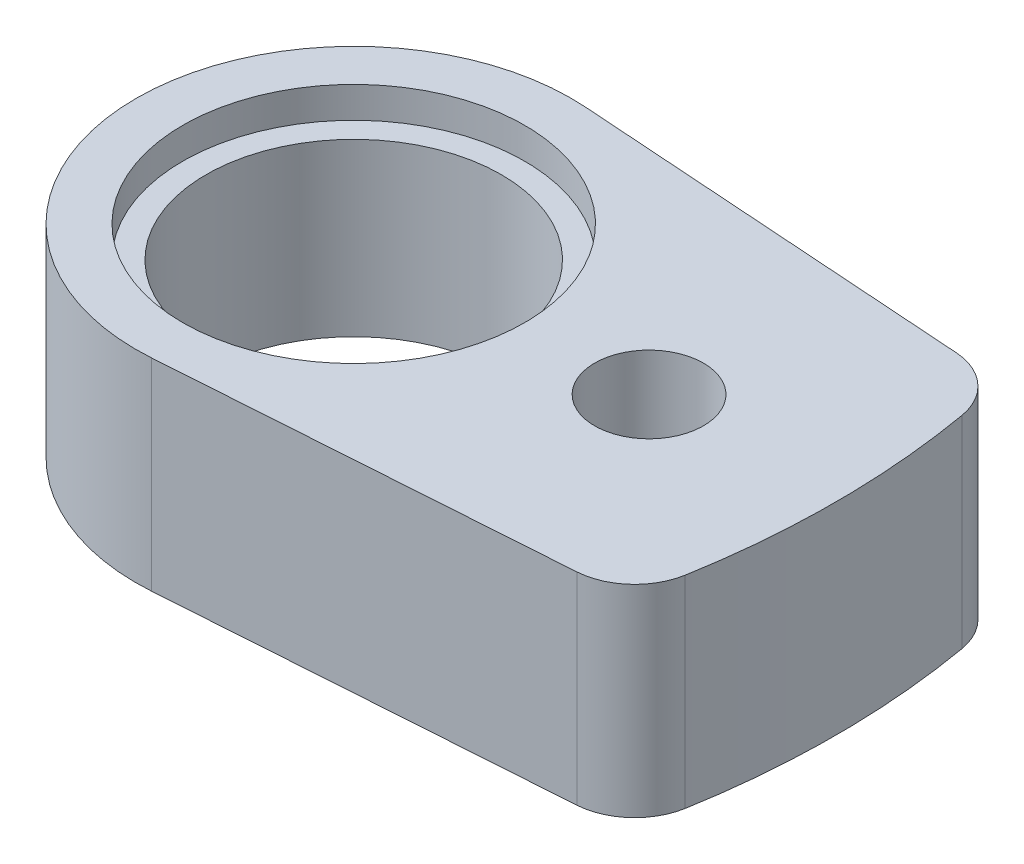
from build123d import *

# Parameters (mm, degrees)
SKETCH1_R           = 9.5
SKETCH1_R_2         = 3.5
BOSS_EXTRUDE1_DEPTH = 13
FILLET1_R           = 4
SKETCH3_R           = 11
CUT_EXTRUDE1_DEPTH  = 2


with BuildPart() as part:
    # Sketch1 → Boss-Extrude1 (new body)
    with BuildSketch(Plane(origin=(0, 0, 0), x_dir=(1, 0, 0), z_dir=(0, 1, 0))):
        with BuildLine():
            Line((0.959404, 13.967087884), (29.596442563, 12))
            ThreePointArc((29.596442563, 12), (31, 0), (29.596442563, -12))
            Line((29.596442563, -12), (0.959404, -13.967087884))
            ThreePointArc((0.959404, -13.967087884), (-14, 0), (0.959404, 13.967087884))
        make_face()
        with Locations(Location((0, 0, 0), (0, 0, 90))):
            Circle(SKETCH1_R, mode=Mode.SUBTRACT)
        with Locations(Location((19, 0, 0), (0, 0, 90))):
            Circle(SKETCH1_R_2, mode=Mode.SUBTRACT)
    extrude(amount=BOSS_EXTRUDE1_DEPTH)

    # Fillet1
    fillet1_edges = [part.edges().sort_by_distance(p)[0] for p in [
        (29.596442563, 6.5, -12),
        (29.596442563, 6.5, 12),
    ]]
    fillet(fillet1_edges, radius=FILLET1_R)

    # Sketch3 → Cut-Extrude1 (cut)
    with BuildSketch(Plane(origin=(0, 13, 0), x_dir=(1, 0, 0), z_dir=(0, 1, 0))):
        with Locations(Location((0, 0, 0), (0, 0, 270))):
            Circle(SKETCH3_R)
    extrude(amount=-CUT_EXTRUDE1_DEPTH, mode=Mode.SUBTRACT)


solid = part.part
